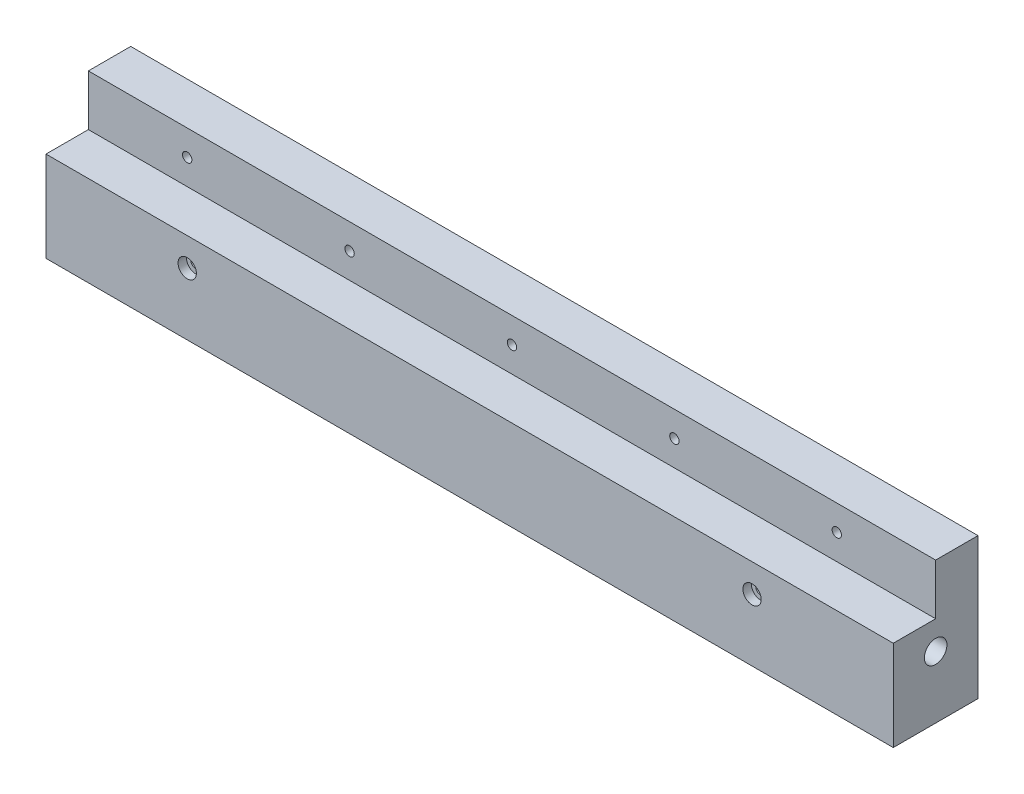
from build123d import *

# Parameters (mm, degrees)
SKETCH1_W                                       = 30
SKETCH1_H                                       = 32
BOSS_EXTRUDE1_DEPTH                             = 150
CUT_EXTRUDE1_REACH                              = 158.282
SKETCH2_W                                       = 15
SKETCH2_H                                       = 18
CUT_EXTRUDE1_DIRECTION_2_REACH                  = 158.282
CUT_EXTRUDE2_DEPTH                              = 161.934769394
CUT_EXTRUDE2_DEPTH_BACK                         = 161.934769394
SKETCH3_R                                       = 4
CBORE_FOR_M3_SOCKET_HEAD_CAP_SCREW1_D           = 3.4
CBORE_FOR_M3_SOCKET_HEAD_CAP_SCREW1_CBORE_D     = 6.5
CBORE_FOR_M3_SOCKET_HEAD_CAP_SCREW1_CBORE_DEPTH = 3
M4X0_7_TAPPED_HOLE1_D                           = 3.3
M5X0_8_TAPPED_HOLE1_D                           = 4.2
M5X0_8_TAPPED_HOLE1_DEPTH                       = 14
M5X0_8_TAPPED_HOLE1_TIP                         = 1.2618073


with BuildPart() as part:
    # Sketch1 → Boss-Extrude1 (new, symmetric)
    with BuildSketch(Plane(origin=(0, 0, 0), x_dir=(0, 0, -1), z_dir=(1, 0, 0))):
        with Locations((-15, 16)):
            Rectangle(SKETCH1_W, SKETCH1_H)
    extrude(amount=BOSS_EXTRUDE1_DEPTH, both=True)

    # Cut-Extrude1: up to this face of the body (flat: up to its plane)
    cut_extrude1_end = Plane(part.part.faces().sort_by_distance((150, 16, 15))[0])
    # Sketch2 → Cut-Extrude1 (add, up to the picked face)
    with BuildSketch(Plane(origin=(0, 0, 0), x_dir=(0, 0, -1), z_dir=(1, 0, 0)), mode=Mode.PRIVATE) as cut_extrude1_sk1:
        with Locations((-7.5, 41)):
            Rectangle(SKETCH2_W, SKETCH2_H)
    cut_extrude1_tool1 = split(extrude(cut_extrude1_sk1.sketch, amount=CUT_EXTRUDE1_REACH, mode=Mode.PRIVATE), bisect_by=cut_extrude1_end, keep=Keep.BOTH, mode=Mode.PRIVATE)
    add(cut_extrude1_tool1.solids().sort_by(Axis((0, 41, 7.5), (1, 0, 0)))[0])

    # Cut-Extrude1 direction 2: up to this face of the body (flat: up to its plane)
    cut_extrude1_direction_2_end = Plane(part.part.faces().sort_by_distance((-150, 16, 15))[0])
    # Sketch2 → Cut-Extrude1 direction 2 (add, up to the picked face)
    with BuildSketch(Plane(origin=(0, 0, 0), x_dir=(0, 0, -1), z_dir=(1, 0, 0)), mode=Mode.PRIVATE) as cut_extrude1_direction_2_sk1:
        with Locations((-7.5, 41)):
            Rectangle(SKETCH2_W, SKETCH2_H)
    cut_extrude1_direction_2_tool1 = split(extrude(cut_extrude1_direction_2_sk1.sketch, amount=-CUT_EXTRUDE1_DIRECTION_2_REACH, mode=Mode.PRIVATE), bisect_by=cut_extrude1_direction_2_end, keep=Keep.BOTH, mode=Mode.PRIVATE)
    add(cut_extrude1_direction_2_tool1.solids().sort_by(Axis((0, 41, 7.5), (-1, 0, 0)))[0])

    # Sketch3 → Cut-Extrude2 (cut, two sides: drawn at the far end of the back side and taken through both)
    with BuildSketch(Plane(origin=(0, 0, 0), x_dir=(0, 0, -1), z_dir=(1, 0, 0)).offset(-CUT_EXTRUDE2_DEPTH_BACK)):
        with Locations((-15, 22)):
            Circle(SKETCH3_R)
    extrude(amount=CUT_EXTRUDE2_DEPTH + CUT_EXTRUDE2_DEPTH_BACK, mode=Mode.SUBTRACT)

    # CBORE for M3 Socket Head Cap Screw1 (through all)
    with Locations(Plane.XY.offset(30)):
        with Locations((100, 22), (-100, 22)):
            CounterBoreHole(CBORE_FOR_M3_SOCKET_HEAD_CAP_SCREW1_D / 2, CBORE_FOR_M3_SOCKET_HEAD_CAP_SCREW1_CBORE_D / 2, CBORE_FOR_M3_SOCKET_HEAD_CAP_SCREW1_CBORE_DEPTH)

    # M4x0.7 Tapped Hole1 (through all)
    with Locations(Plane.XY.offset(15)):
        with Locations((115, 41), (57.5, 41), (0, 41), (-57.5, 41), (-115, 41)):
            Hole(M4X0_7_TAPPED_HOLE1_D / 2)

    # M5x0.8 Tapped Hole1
    with Locations(Plane.XZ):
        with Locations((-80, 24), (-80, 6), (80, 6), (80, 24)):
            Hole(M5X0_8_TAPPED_HOLE1_D / 2, depth=M5X0_8_TAPPED_HOLE1_DEPTH)
            with Locations((0, 0, -(M5X0_8_TAPPED_HOLE1_DEPTH + M5X0_8_TAPPED_HOLE1_TIP / 2))):  # 118° drill point
                Cone(0, M5X0_8_TAPPED_HOLE1_D / 2, M5X0_8_TAPPED_HOLE1_TIP, mode=Mode.SUBTRACT)


solid = part.part
